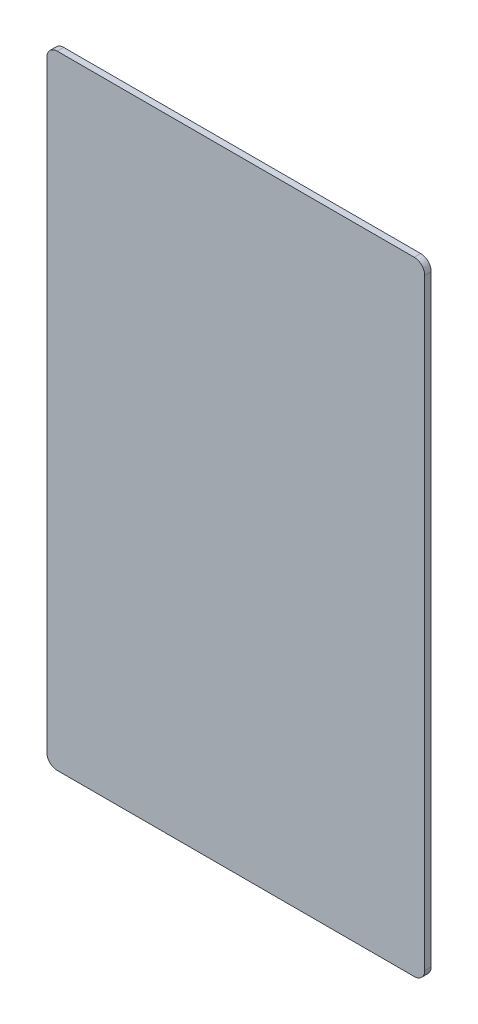
from build123d import *

# Parameters (mm, degrees)
BOSS_EXTRUDE1_DEPTH = 1.85
SKETCH2_W           = 95
SKETCH2_H           = 164
BOSS_EXTRUDE2_DEPTH = 5.75


with BuildPart() as part:
    # Sketch1 → Boss-Extrude1 (new body)
    with BuildSketch(Plane.XY):
        with BuildLine():
            Line((-51, 89), (51, 89))
            ThreePointArc((51, 89), (53.121320344, 88.121320344), (54, 86))
            Line((54, 86), (54, -86))
            ThreePointArc((54, -86), (53.121320344, -88.121320344), (51, -89))
            Line((51, -89), (-51, -89))
            ThreePointArc((-51, -89), (-53.121320344, -88.121320344), (-54, -86))
            Line((-54, -86), (-54, 86))
            ThreePointArc((-54, 86), (-53.121320344, 88.121320344), (-51, 89))
        make_face()
    extrude(amount=BOSS_EXTRUDE1_DEPTH)

    # Sketch2 → Boss-Extrude2 (add)
    with BuildSketch(Plane.XY.offset(1.85)):
        with Locations((1.5, -1)):
            Rectangle(SKETCH2_W, SKETCH2_H)
    extrude(amount=-BOSS_EXTRUDE2_DEPTH)


solid = part.part
